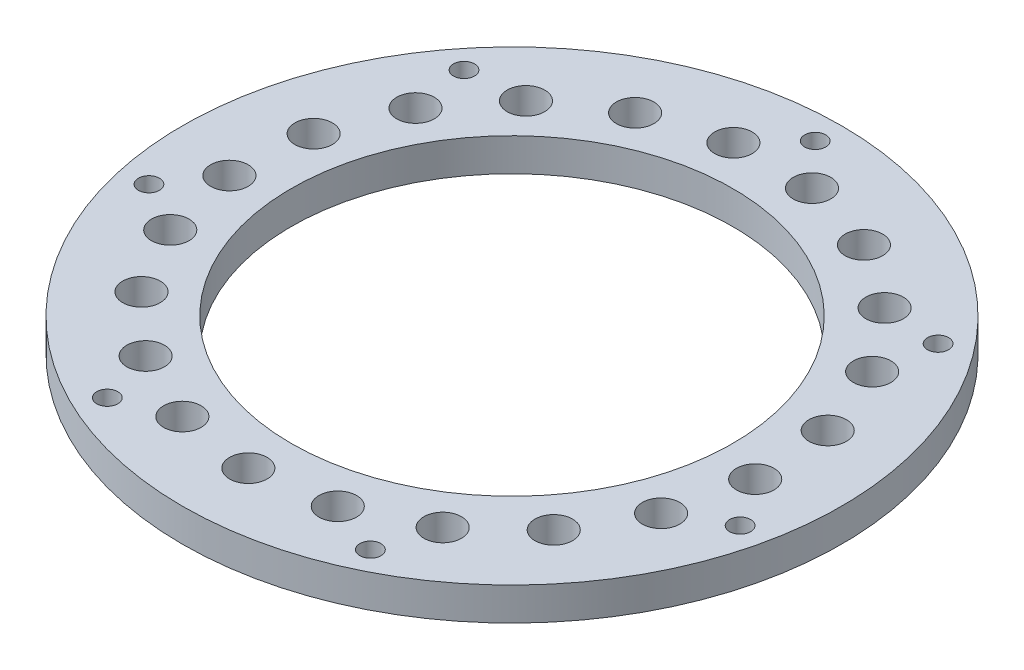
from build123d import *

# Parameters (mm, degrees)
SKIZZE1_R                        = 50
SKIZZE1_R_2                      = 33.5
AUFSATZ_LINEAR_AUSTRAGEN1_DEPTH  = 5
F_3_2_3_2_DURCHMESSER_BOHRUNG2_D = 3.2
KREISMUSTER1_COUNT               = 7
F_5_6_5_6_DURCHMESSER_BOHRUNG2_D = 5.7
KREISMUSTER2_COUNT               = 21


with BuildPart() as part:
    # Skizze1 → Aufsatz-Linear austragen1 (new body)
    with BuildSketch(Plane(origin=(0, 0, 0), x_dir=(1, 0, 0), z_dir=(0, 1, 0))):
        with Locations(Location((0, 0, 0), (0, 0, 270))):
            Circle(SKIZZE1_R)
        with Locations(Location((0, 0, 0), (0, 0, 270))):
            Circle(SKIZZE1_R_2, mode=Mode.SUBTRACT)
    extrude(amount=AUFSATZ_LINEAR_AUSTRAGEN1_DEPTH)

    # Ø3.2 (3.2) Durchmesser Bohrung2 (through all)
    with Locations(Plane(origin=(0, 5, 0), x_dir=(1, 0, 0), z_dir=(0, 1, 0))):
        with Locations((0, 46)):
            f_3_2_3_2_durchmesser_bohrung2 = Hole(F_3_2_3_2_DURCHMESSER_BOHRUNG2_D / 2)

    # Kreismuster1: Ø3.2 (3.2) Durchmesser Bohrung2 ×7 about axis
    kreismuster1_axis = Axis((0, 0, 0), (0, 1, 0))
    for i in range(1, KREISMUSTER1_COUNT):
        add(f_3_2_3_2_durchmesser_bohrung2.rotate(kreismuster1_axis, i * 360 / KREISMUSTER1_COUNT), mode=Mode.SUBTRACT)

    # Ø5.6 (5.6) Durchmesser Bohrung2 (through all)
    with Locations(Plane(origin=(0, 5, 0), x_dir=(1, 0, 0), z_dir=(0, 1, 0))):
        with Locations((0, -40)):
            f_5_6_5_6_durchmesser_bohrung2 = Hole(F_5_6_5_6_DURCHMESSER_BOHRUNG2_D / 2)

    # Kreismuster2: Ø5.6 (5.6) Durchmesser Bohrung2 ×21 about axis
    kreismuster2_axis = Axis((0, 0, 0), (0, 1, 0))
    for i in range(1, KREISMUSTER2_COUNT):
        add(f_5_6_5_6_durchmesser_bohrung2.rotate(kreismuster2_axis, i * 360 / KREISMUSTER2_COUNT), mode=Mode.SUBTRACT)


solid = part.part
